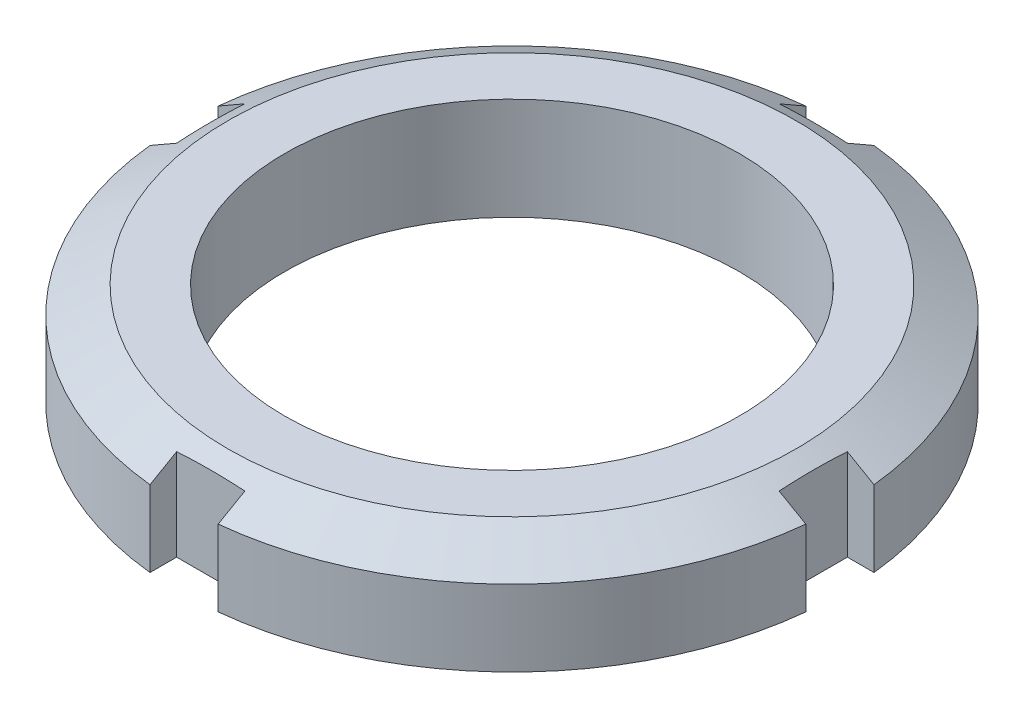
from build123d import *

# Parameters (mm, degrees)
CROQUIS1_R              = 29
CROQUIS1_R_2            = 20
SALIENTE_EXTRUIR1_DEPTH = 9
CORTAR_EXTRUIR1_REACH   = 43.988
CROQUIS2_W              = 6
CROQUIS2_H              = 2.5
CROQUIS2_W_2            = 2.5
CROQUIS2_H_2            = 6


with BuildPart() as part:
    # Croquis1 → Saliente-Extruir1 (new body)
    with BuildSketch(Plane(origin=(0, 0, 0), x_dir=(1, 0, 0), z_dir=(0, 1, 0))):
        with Locations(Location((0, 0, 0), (0, 0, 270))):
            Circle(CROQUIS1_R)
        with Locations(Location((0, 0, 0), (0, 0, 270))):
            Circle(CROQUIS1_R_2, mode=Mode.SUBTRACT)
    extrude(amount=SALIENTE_EXTRUIR1_DEPTH)

    # Croquis2 → Cortar-Extruir1 (cut, up to next)
    with BuildSketch(Plane(origin=(0, 9, 0), x_dir=(1, 0, 0), z_dir=(0, 1, 0)), mode=Mode.PRIVATE) as cortar_extruir1_sk1:
        with Locations((0, 27.75)):
            Rectangle(CROQUIS2_W, CROQUIS2_H)
    cortar_extruir1_tool1 = extrude(cortar_extruir1_sk1.sketch, amount=-CORTAR_EXTRUIR1_REACH, mode=Mode.PRIVATE) & part.part
    # Croquis2 → Cortar-Extruir1 (cut, up to next)
    with BuildSketch(Plane(origin=(0, 9, 0), x_dir=(1, 0, 0), z_dir=(0, 1, 0)), mode=Mode.PRIVATE) as cortar_extruir1_sk2:
        with Locations((0, -27.75)):
            Rectangle(CROQUIS2_W, CROQUIS2_H)
    cortar_extruir1_tool2 = extrude(cortar_extruir1_sk2.sketch, amount=-CORTAR_EXTRUIR1_REACH, mode=Mode.PRIVATE) & part.part
    # Croquis2 → Cortar-Extruir1 (cut, up to next)
    with BuildSketch(Plane(origin=(0, 9, 0), x_dir=(1, 0, 0), z_dir=(0, 1, 0)), mode=Mode.PRIVATE) as cortar_extruir1_sk3:
        with Locations((27.75, 0)):
            Rectangle(CROQUIS2_W_2, CROQUIS2_H_2)
    cortar_extruir1_tool3 = extrude(cortar_extruir1_sk3.sketch, amount=-CORTAR_EXTRUIR1_REACH, mode=Mode.PRIVATE) & part.part
    # Croquis2 → Cortar-Extruir1 (cut, up to next)
    with BuildSketch(Plane(origin=(0, 9, 0), x_dir=(1, 0, 0), z_dir=(0, 1, 0)), mode=Mode.PRIVATE) as cortar_extruir1_sk4:
        with Locations((-27.75, 0)):
            Rectangle(CROQUIS2_W_2, CROQUIS2_H_2)
    cortar_extruir1_tool4 = extrude(cortar_extruir1_sk4.sketch, amount=-CORTAR_EXTRUIR1_REACH, mode=Mode.PRIVATE) & part.part
    add(cortar_extruir1_tool1.solids().sort_by_distance((0, 9, -27.75))[0], mode=Mode.SUBTRACT)
    add(cortar_extruir1_tool2.solids().sort_by_distance((0, 9, 27.75))[0], mode=Mode.SUBTRACT)
    add(cortar_extruir1_tool3.solids().sort_by_distance((27.75, 9, 0))[0], mode=Mode.SUBTRACT)
    add(cortar_extruir1_tool4.solids().sort_by_distance((-27.75, 9, 0))[0], mode=Mode.SUBTRACT)

    # Croquis3 → Cortar-Revolución1 (revolve, cut)
    with BuildSketch(Plane(origin=(0, 0, 0), x_dir=(0, 0, -1), z_dir=(1, 0, 0)), mode=Mode.PRIVATE) as cortar_revoluci_n1_sk:
        Polygon((-29, 9), (-25, 9), (-29, 6.690598923), align=None)
    revolve(cortar_revoluci_n1_sk.sketch.rotate(Axis((0, 9, 0), (0, -1, 0)), 185.937772452), axis=Axis((0, 9, 0), (0, -1, 0)), mode=Mode.SUBTRACT)


solid = part.part
